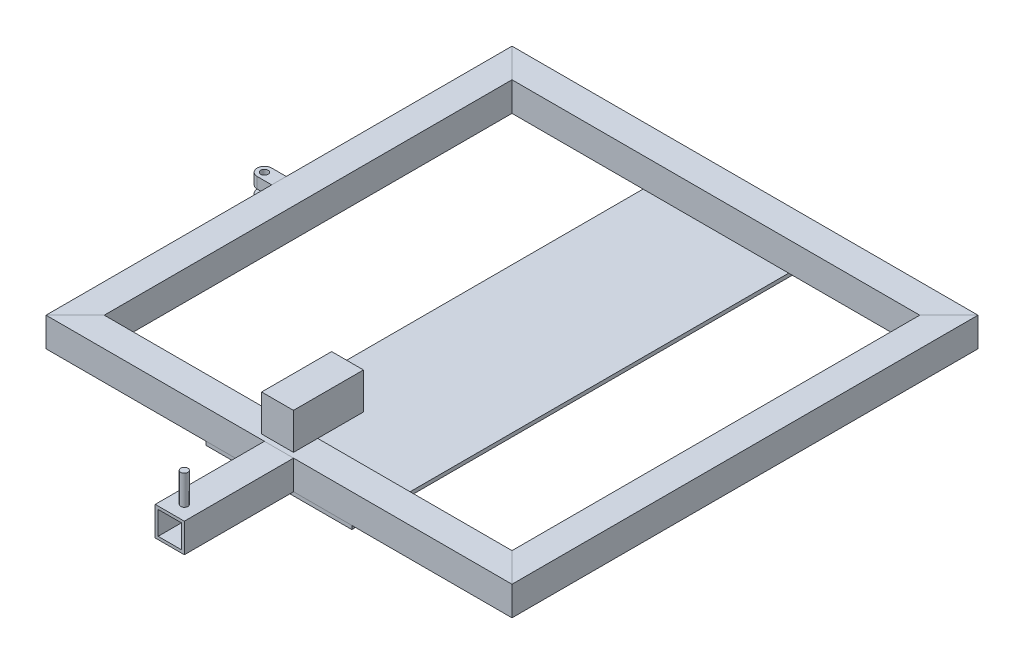
from build123d import *

# Parameters (mm, degrees)
TUBO_CUADRADO_20_X_20_X_2_2_DEPTH      = 315.142135624
TUBO_CUADRADO_20_X_20_X_2_2_DEPTH_BACK = 15.142135624
SKETCH1_W                              = 20
SKETCH1_H                              = 20
SKETCH1_W_2                            = 16
SKETCH1_H_2                            = 16
SKETCH1_ON_SEGMENT_2_W                 = 20
SKETCH1_ON_SEGMENT_2_H                 = 20
SKETCH1_ON_SEGMENT_2_W_2               = 16
SKETCH1_ON_SEGMENT_2_H_2               = 16
TUBO_CUADRADO_20_X_20_X_2_2_2_DEPTH    = 330.284271247
SKETCH1_ON_SEGMENT_3_W                 = 20
SKETCH1_ON_SEGMENT_3_H                 = 20
SKETCH1_ON_SEGMENT_3_W_2               = 16
SKETCH1_ON_SEGMENT_3_H_2               = 16
TUBO_CUADRADO_20_X_20_X_2_2_3_DEPTH    = 330.284271247
SKETCH1_ON_SEGMENT_4_W                 = 20
SKETCH1_ON_SEGMENT_4_H                 = 20
SKETCH1_ON_SEGMENT_4_W_2               = 16
SKETCH1_ON_SEGMENT_4_H_2               = 16
TUBO_CUADRADO_20_X_20_X_2_2_4_DEPTH    = 330.284271247
CROQUIS3_W                             = 100
CROQUIS3_H                             = 320
SALIENTE_EXTRUIR1_DEPTH                = 2.5
CROQUIS7_R                             = 2.5
SALIENTE_EXTRUIR2_DEPTH                = 20
CROQUIS9_W                             = 12.514211711
CROQUIS9_H                             = 5
CORTAR_EXTRUIR1_DEPTH                  = 33
TUBO_CUADRADO_20_X_20_X_2_4_DEPTH      = 75
CROQUIS12_R                            = 2.5
SALIENTE_EXTRUIR3_DEPTH                = 20.3
CROQUIS13_W                            = 21.859399814
CROQUIS13_H                            = 48.070128995
SALIENTE_EXTRUIR4_DEPTH                = 25


with BuildPart() as part:
    # Sketch1 → Tubo cuadrado 20 X 20 X 2(2) (new, two sides: drawn at the far end of the back side and taken through both)
    with BuildSketch(Plane(origin=(-150, 0, -150), x_dir=(1, 0, 0), z_dir=(0, 0, 1)).offset(-TUBO_CUADRADO_20_X_20_X_2_2_DEPTH_BACK)):
        Rectangle(SKETCH1_W, SKETCH1_H)
        Rectangle(SKETCH1_W_2, SKETCH1_H_2, mode=Mode.SUBTRACT)
    extrude(amount=TUBO_CUADRADO_20_X_20_X_2_2_DEPTH + TUBO_CUADRADO_20_X_20_X_2_2_DEPTH_BACK)

    # Tubo cuadrado 20 X 20 X 2(2) mitre 1
    split(bisect_by=Plane(origin=(-150, 0, -150), x_dir=(0, -1, 0), z_dir=(-0.707106781, 0, 0.707106781)), keep=Keep.TOP)

    # Tubo cuadrado 20 X 20 X 2(2) mitre 2
    split(bisect_by=Plane(origin=(-150, 0, 150), x_dir=(0, -1, 0), z_dir=(-0.707106781, 0, -0.707106781)), keep=Keep.TOP)


with BuildPart() as body_2:
    # Sketch1 on segment 2 (carried to segment 2) → Tubo cuadrado 20 X 20 X 2_2 2 (new body)
    with BuildSketch(Plane(origin=(-165.142135624, 0, 150), x_dir=(0, 0, -1), z_dir=(1, 0, 0))):
        Rectangle(SKETCH1_ON_SEGMENT_2_W, SKETCH1_ON_SEGMENT_2_H)
        Rectangle(SKETCH1_ON_SEGMENT_2_W_2, SKETCH1_ON_SEGMENT_2_H_2, mode=Mode.SUBTRACT)
    extrude(amount=TUBO_CUADRADO_20_X_20_X_2_2_2_DEPTH)

    # Tubo cuadrado 20 X 20 X 2_2 2 mitre 1
    split(bisect_by=Plane(origin=(-150, 0, 150), x_dir=(0, 1, 0), z_dir=(0.707106781, 0, 0.707106781)), keep=Keep.TOP)

    # Tubo cuadrado 20 X 20 X 2_2 2 mitre 2
    split(bisect_by=Plane(origin=(150, 0, 150), x_dir=(0, -1, 0), z_dir=(-0.707106781, 0, 0.707106781)), keep=Keep.TOP)


with BuildPart() as body_3:
    # Sketch1 on segment 3 (carried to segment 3) → Tubo cuadrado 20 X 20 X 2_2 3 (new body)
    with BuildSketch(Plane(origin=(150, 0, 165.142135624), x_dir=(-1, 0, 0), z_dir=(0, 0, -1))):
        Rectangle(SKETCH1_ON_SEGMENT_3_W, SKETCH1_ON_SEGMENT_3_H)
        Rectangle(SKETCH1_ON_SEGMENT_3_W_2, SKETCH1_ON_SEGMENT_3_H_2, mode=Mode.SUBTRACT)
    extrude(amount=TUBO_CUADRADO_20_X_20_X_2_2_3_DEPTH)

    # Tubo cuadrado 20 X 20 X 2_2 3 mitre 1
    split(bisect_by=Plane(origin=(150, 0, -150), x_dir=(0, 1, 0), z_dir=(0.707106781, 0, 0.707106781)), keep=Keep.TOP)

    # Tubo cuadrado 20 X 20 X 2_2 3 mitre 2
    split(bisect_by=Plane(origin=(150, 0, 150), x_dir=(0, 1, 0), z_dir=(0.707106781, 0, -0.707106781)), keep=Keep.TOP)


with BuildPart() as body_4:
    # Sketch1 on segment 4 (carried to segment 4) → Tubo cuadrado 20 X 20 X 2_2 4 (new body)
    with BuildSketch(Plane(origin=(165.142135624, 0, -150), x_dir=(0, 0, 1), z_dir=(-1, 0, 0))):
        Rectangle(SKETCH1_ON_SEGMENT_4_W, SKETCH1_ON_SEGMENT_4_H)
        Rectangle(SKETCH1_ON_SEGMENT_4_W_2, SKETCH1_ON_SEGMENT_4_H_2, mode=Mode.SUBTRACT)
    extrude(amount=TUBO_CUADRADO_20_X_20_X_2_2_4_DEPTH)

    # Tubo cuadrado 20 X 20 X 2_2 4 mitre 1
    split(bisect_by=Plane(origin=(-150, 0, -150), x_dir=(0, 1, 0), z_dir=(0.707106781, 0, -0.707106781)), keep=Keep.TOP)

    # Tubo cuadrado 20 X 20 X 2_2 4 mitre 2
    split(bisect_by=Plane(origin=(150, 0, -150), x_dir=(0, -1, 0), z_dir=(-0.707106781, 0, -0.707106781)), keep=Keep.TOP)


with BuildPart() as body_5:
    # Croquis3 → Saliente-Extruir1 (new body)
    with BuildSketch(Plane(origin=(0, -10, 0), x_dir=(1, 0, 0), z_dir=(0, 1, 0))):
        Rectangle(CROQUIS3_W, CROQUIS3_H)
    extrude(amount=-SALIENTE_EXTRUIR1_DEPTH)


with BuildPart() as body_6:
    # Croquis7 → Saliente-Extruir2 (new body)
    with BuildSketch(Plane(origin=(0, 10, 0), x_dir=(1, 0, 0), z_dir=(0, 1, 0))):
        with BuildLine():
            Line((-160, 0), (-160, 5))
            Line((-160, 5), (-170, 5))
            ThreePointArc((-170, 5), (-175, 0), (-170, -5))
            Line((-170, -5), (-160, -5))
            Line((-160, -5), (-160, 0))
        make_face()
        with Locations(Location((-170, 0, 0), (0, 0, 270))):
            Circle(CROQUIS7_R, mode=Mode.SUBTRACT)
    extrude(amount=-SALIENTE_EXTRUIR2_DEPTH)

    # Croquis9 → Cortar-Extruir1 (cut)
    with BuildSketch(Plane.XY.offset(5)):
        with Locations((-171.257105856, 0)):
            Rectangle(CROQUIS9_W, CROQUIS9_H)
    extrude(amount=-CORTAR_EXTRUIR1_DEPTH, mode=Mode.SUBTRACT)


with BuildPart() as body_7:
    # Sketch11 → Tubo cuadrado 20 X 20 X 2(4) (new body)
    with BuildSketch(Plane.XY.offset(160)):
        Polygon((-6, -10), (6, -10), (10, -10), (10, -6), (10, 6), (10, 10), (6, 10), (-6, 10), (-10, 10), (-10, 6), (-10, -6), (-10, -10), align=None)
        Polygon((-6, -8), (6, -8), (8, -8), (8, -6), (8, 6), (8, 8), (6, 8), (-6, 8), (-8, 8), (-8, 6), (-8, -6), (-8, -8), align=None, mode=Mode.SUBTRACT)
    extrude(amount=TUBO_CUADRADO_20_X_20_X_2_4_DEPTH)


with BuildPart() as body_8:
    # Croquis12 → Saliente-Extruir3 (new body)
    with BuildSketch(Plane(origin=(0, 10, 0), x_dir=(1, 0, 0), z_dir=(0, 1, 0))):
        with Locations(Location((0, -225, 0), (0, 0, 180))):
            Circle(CROQUIS12_R)
    extrude(amount=SALIENTE_EXTRUIR3_DEPTH)


with BuildPart() as body_9:
    # Croquis13 → Saliente-Extruir4 (new body)
    with BuildSketch(Plane(origin=(0, 30.3, 0), x_dir=(1, 0, 0), z_dir=(0, 1, 0))):
        with Locations((15.929699907, -152.894806508)):
            Rectangle(CROQUIS13_W, CROQUIS13_H)
    extrude(amount=SALIENTE_EXTRUIR4_DEPTH)


solid = Compound([part.part, body_2.part, body_3.part, body_4.part, body_5.part, body_6.part, body_7.part, body_8.part, body_9.part])
